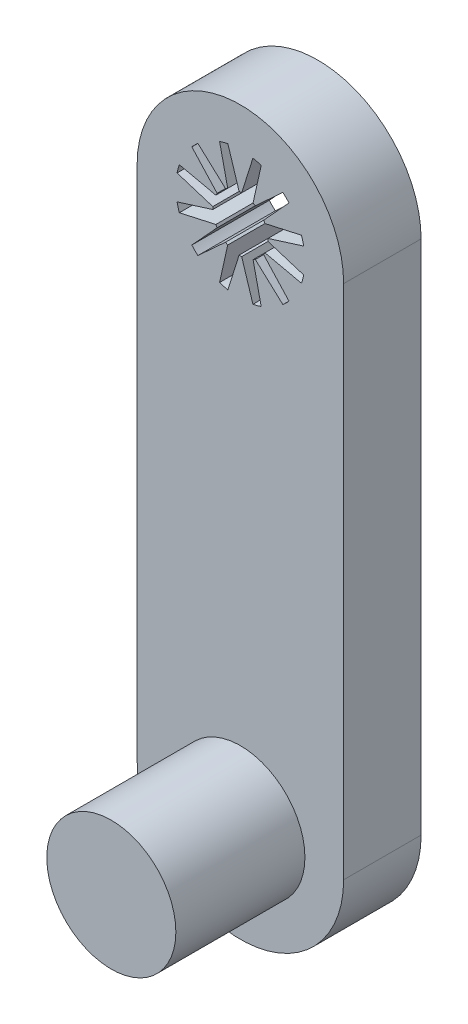
from build123d import *

# Parameters (mm, degrees)
BOSS_EXTRUDE1_DEPTH = 3
CUT_EXTRUDE2_REACH  = 22.661
SKETCH4_R           = 2.5
BOSS_EXTRUDE4_DEPTH = 3
SKETCH6_R           = 2.5
BOSS_EXTRUDE5_DEPTH = 5


with BuildPart() as part:
    # Sketch1 → Boss-Extrude1 (new body)
    with BuildSketch(Plane(origin=(0, 0, 0), x_dir=(0, 1, 0), z_dir=(0, 0, 1))):
        with BuildLine():
            Line((-16.029850746, -4.082089552), (3.970149254, -4.082089552))
            ThreePointArc((3.970149254, -4.082089552), (7.970149254, -0.082089552), (3.970149254, 3.917910448))
            Line((3.970149254, 3.917910448), (-16.029850746, 3.917910448))
            ThreePointArc((-16.029850746, 3.917910448), (-20.029850746, -0.082089552), (-16.029850746, -4.082089552))
        make_face()
    extrude(amount=BOSS_EXTRUDE1_DEPTH)

    # Sketch4 → Cut-Extrude2 (cut, up to next)
    with BuildSketch(Plane(origin=(0, 0, 3), x_dir=(0, -1, 0), z_dir=(0, 0, 1)), mode=Mode.PRIVATE) as cut_extrude2_sk1:
        with Locations(Location((-3.970149254, 0.082089552, 0), (0, 0, 90))):
            Circle(SKETCH4_R)
    cut_extrude2_tool1 = extrude(cut_extrude2_sk1.sketch, amount=-CUT_EXTRUDE2_REACH, mode=Mode.PRIVATE) & part.part
    add(cut_extrude2_tool1.solids().sort_by_distance((0.08209, 3.970149, 3))[0], mode=Mode.SUBTRACT)

    # Sketch5 → Boss-Extrude4 (add)
    with BuildSketch(Plane.XY.offset(3)):
        Polygon((-0.417910448, 1.470149254), (0.582089552, 1.470149254), (0.132089552, 2.901058056), (0.032089552, 2.901058056), align=None)
        Polygon((-1.60092315, 2.055085744), (-0.734897746, 1.555085744), (-0.409154777, 3.019289117), (-0.495757317, 3.069289117), align=None)
        Polygon((-2.332973957, 3.153161956), (-1.832973957, 2.287136552), (-0.818770584, 3.392302385), (-0.868770584, 3.478904925), align=None)
        Polygon((-2.417910448, 4.470149254), (-2.417910448, 3.470149254), (-0.987001646, 3.920149254), (-0.987001646, 4.020149254), align=None)
        Polygon((-1.832973957, 5.653161956), (-2.332973957, 4.787136552), (-0.868770584, 4.461393582), (-0.818770584, 4.547996123), align=None)
        Polygon((-0.734897746, 6.385212763), (-1.60092315, 5.885212763), (-0.495757317, 4.87100939), (-0.409154777, 4.92100939), align=None)
        Polygon((0.582089552, 6.470149254), (-0.417910448, 6.470149254), (0.032089552, 5.039240452), (0.132089552, 5.039240452), align=None)
        Polygon((1.765102254, 5.885212763), (0.89907685, 6.385212763), (0.573333881, 4.92100939), (0.659936421, 4.87100939), align=None)
        Polygon((2.497153062, 4.787136552), (1.997153062, 5.653161956), (0.982949689, 4.547996123), (1.032949689, 4.461393582), align=None)
        Polygon((2.582089552, 3.470149254), (2.582089552, 4.470149254), (1.15118075, 4.020149254), (1.15118075, 3.920149254), align=None)
        Polygon((1.997153062, 2.287136552), (2.497153062, 3.153161956), (1.032949689, 3.478904925), (0.982949689, 3.392302385), align=None)
        Polygon((0.89907685, 1.555085744), (1.765102254, 2.055085744), (0.659936421, 3.069289117), (0.573333881, 3.019289117), align=None)
    extrude(amount=-BOSS_EXTRUDE4_DEPTH)

    # Sketch6 → Boss-Extrude5 (add)
    with BuildSketch(Plane.XY.offset(3)):
        with Locations((0.082089552, -16.029850746)):
            Circle(SKETCH6_R)
    extrude(amount=BOSS_EXTRUDE5_DEPTH)


solid = part.part
